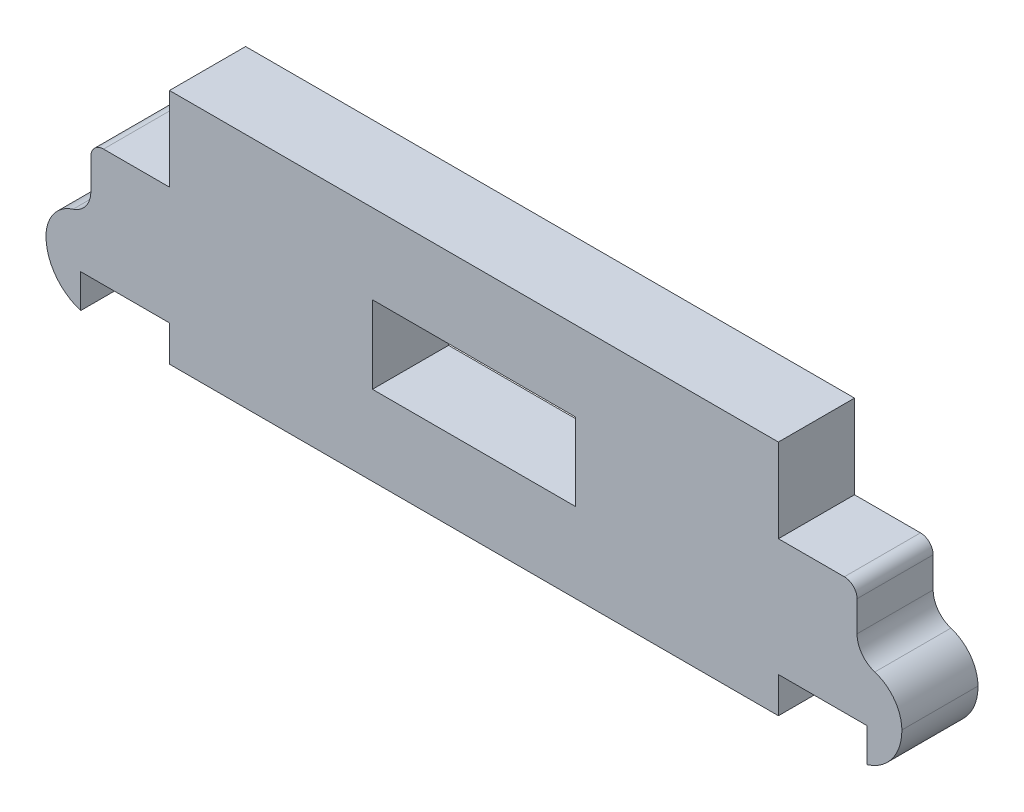
from build123d import *

# Parameters (mm, degrees)
SKETCH1_W           = 8
SKETCH1_H           = 3.056305014
BOSS_EXTRUDE1_DEPTH = 1.5


with BuildPart() as part:
    # Sketch1 → Boss-Extrude1 (new, symmetric)
    with BuildSketch(Plane.XY):
        with BuildLine():
            Line((-10.083709216, 9.599779274), (-10.083709216, 6.299779274))
            Line((-10.083709216, 6.299779274), (-12.68296021, 6.299779274))
            ThreePointArc((-12.68296021, 6.299779274), (-13.0365136, 6.153332664), (-13.18296021, 5.799779274))
            Line((-13.18296021, 5.799779274), (-13.18296021, 4.602368782))
            ThreePointArc((-13.18296021, 4.602368782), (-13.376633784, 4.010897992), (-13.882635601, 3.648531727))
            ThreePointArc((-13.882635601, 3.648531727), (-14.651645992, 3.099880506), (-14.950395595, 2.20369759))
            ThreePointArc((-14.950395595, 2.20369759), (-14.575936583, 1.043545253), (-13.583709216, 0.335267166))
            Line((-13.583709216, 0.335267166), (-13.583709216, 1.664695612))
            Line((-13.583709216, 1.664695612), (-10.083709216, 1.664695612))
            Line((-10.083709216, 1.664695612), (-10.083709216, 0.256084288))
            Line((-10.083709216, 0.256084288), (13.916290784, 0.256084288))
            Line((13.916290784, 0.256084288), (13.916290784, 1.664695612))
            Line((13.916290784, 1.664695612), (17.416290784, 1.664695612))
            Line((17.416290784, 1.664695612), (17.416290784, 0.335267166))
            ThreePointArc((17.416290784, 0.335267166), (18.408518152, 1.043545253), (18.782977164, 2.20369759))
            ThreePointArc((18.782977164, 2.20369759), (18.484227561, 3.099880506), (17.715217169, 3.648531727))
            ThreePointArc((17.715217169, 3.648531727), (17.209215353, 4.010897992), (17.015541778, 4.602368782))
            Line((17.015541778, 4.602368782), (17.015541778, 5.799779274))
            ThreePointArc((17.015541778, 5.799779274), (16.869095169, 6.153332664), (16.515541778, 6.299779274))
            Line((16.515541778, 6.299779274), (13.916290784, 6.299779274))
            Line((13.916290784, 6.299779274), (13.916290784, 9.599779274))
            Line((13.916290784, 9.599779274), (-10.083709216, 9.599779274))
        make_face()
        with Locations((1.916290784, 4.927931781)):
            Rectangle(SKETCH1_W, SKETCH1_H, mode=Mode.SUBTRACT)
    extrude(amount=BOSS_EXTRUDE1_DEPTH, both=True)


solid = part.part
